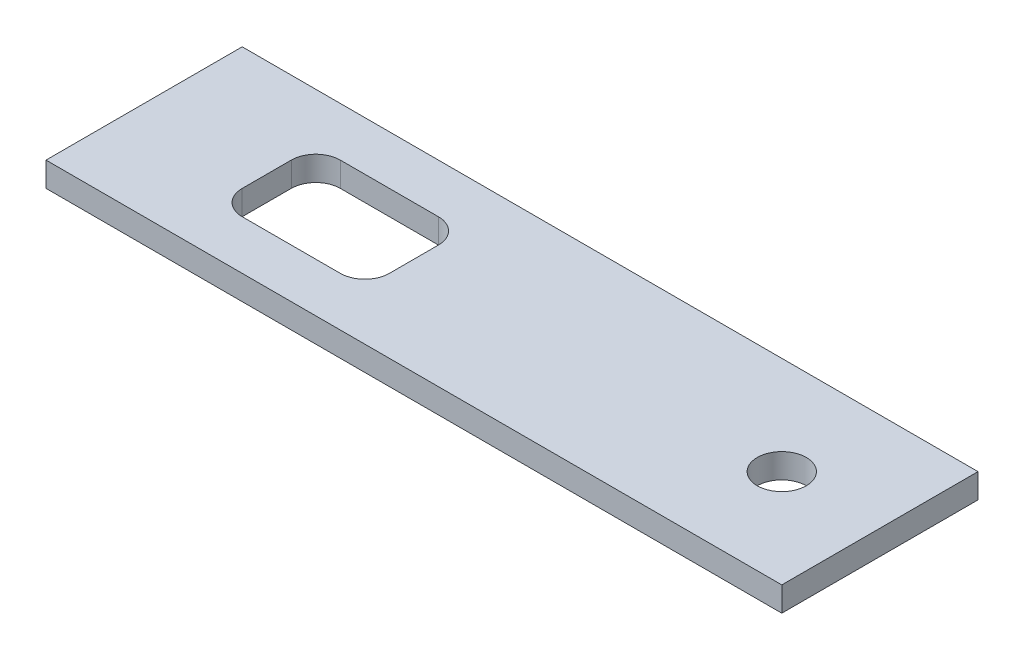
from build123d import *

# Parameters (mm, degrees)
SKETCH1_R           = 3.175
BOSS_EXTRUDE1_DEPTH = 3.175


with BuildPart() as part:
    # Sketch1 → Boss-Extrude1 (new body)
    with BuildSketch(Plane(origin=(0, 0, 0), x_dir=(1, 0, 0), z_dir=(0, 1, 0))):
        Polygon((0, 4.7625), (0, 0), (6.35, 0), (44.45, 0), (57.15, 0), (95.25, 0), (95.25, 25.4), (57.15, 25.4), (44.45, 25.4), (6.35, 25.4), (0, 25.4), (0, 20.6375), align=None)
        with Locations(Location((82.55, 12.7, 0), (0, 0, 270))):
            Circle(SKETCH1_R, mode=Mode.SUBTRACT)
        with BuildLine():
            ThreePointArc((15.875, 15.875), (16.80493597, 18.12006403), (19.05, 19.05))
            Line((19.05, 19.05), (31.75, 19.05))
            ThreePointArc((31.75, 19.05), (33.99506403, 18.12006403), (34.925, 15.875))
            Line((34.925, 15.875), (34.925, 9.525))
            ThreePointArc((34.925, 9.525), (33.99506403, 7.27993597), (31.75, 6.35))
            Line((31.75, 6.35), (19.05, 6.35))
            ThreePointArc((19.05, 6.35), (16.80493597, 7.27993597), (15.875, 9.525))
            Line((15.875, 9.525), (15.875, 15.875))
        make_face(mode=Mode.SUBTRACT)
    extrude(amount=BOSS_EXTRUDE1_DEPTH)


solid = part.part
